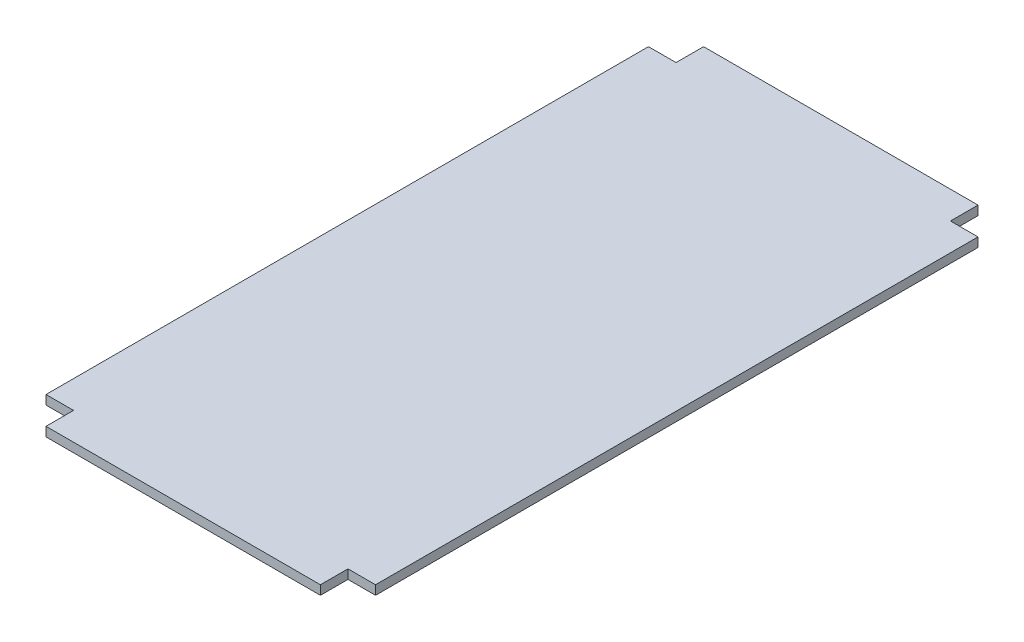
from build123d import *

# Parameters (mm, degrees)
SKETCH1_W           = 227.838
SKETCH1_H           = 454.66
BOSS_EXTRUDE1_DEPTH = 6.35
SKETCH2_W           = 19.05
SKETCH2_H           = 19.05
CUT_EXTRUDE1_DEPTH  = 509.592363631


with BuildPart() as part:
    # Sketch1 → Boss-Extrude1 (new body)
    with BuildSketch(Plane(origin=(0, 0, 0), x_dir=(1, 0, 0), z_dir=(0, 1, 0))):
        with Locations((113.919, 227.33)):
            Rectangle(SKETCH1_W, SKETCH1_H)
    extrude(amount=BOSS_EXTRUDE1_DEPTH)

    # Sketch2 → Cut-Extrude1 (cut, through all)
    with BuildSketch(Plane(origin=(0, 6.35, 0), x_dir=(1, 0, 0), z_dir=(0, 1, 0))):
        with Locations((9.525, 9.525)):
            Rectangle(SKETCH2_W, SKETCH2_H)
        with Locations((9.525, 445.135)):
            Rectangle(SKETCH2_W, SKETCH2_H)
        with Locations((218.313, 445.135)):
            Rectangle(SKETCH2_W, SKETCH2_H)
        with Locations((218.313, 9.525)):
            Rectangle(SKETCH2_W, SKETCH2_H)
    extrude(amount=-CUT_EXTRUDE1_DEPTH, mode=Mode.SUBTRACT)


solid = part.part
